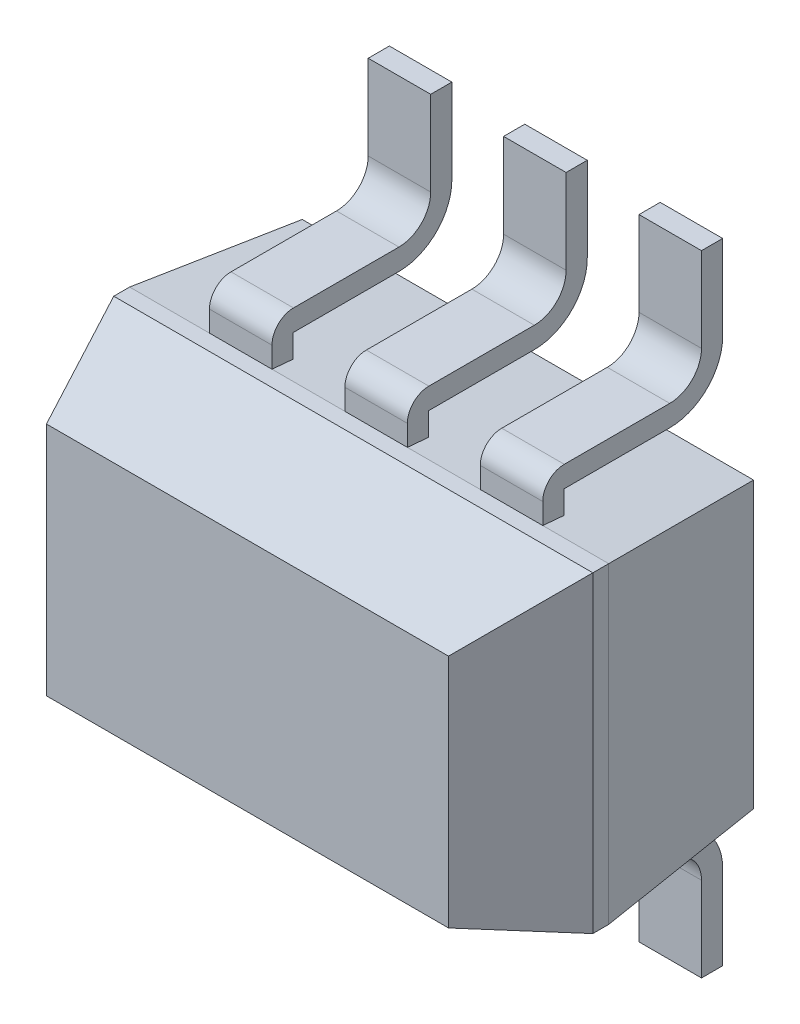
from build123d import *
from OCP.BRepFilletAPI import BRepFilletAPI_MakeChamfer

# Parameters (mm, degrees)
SKETCH1_W                = 2.3
SKETCH1_H                = 1.5
BASE_EXTRUDE_DEPTH       = 1.3462
CHAMFER1_SIZE            = 0.508
CHAMFER1_SIZE2           = 0.184896879
CHAMFER2_SIZE            = 0.762
CHAMFER2_SIZE2           = 0.066666362
SKETCH3_R                = 0.15
CUT_EXTRUDE1_DEPTH       = 0.127
BOSS_EXTRUDE_THIN3_DEPTH = 0.15
LPATTERN1_COUNT          = 3
LPATTERN1_PITCH          = 0.65
MIRROR1_COPY_1_DEPTH     = 0.15
MIRROR1_COPY_2_DEPTH     = 0.15


with BuildPart() as part:
    # Sketch1 → Base-Extrude (new body)
    with BuildSketch(Plane.XY):
        with Locations((3.200498433, 1.512)):
            Rectangle(SKETCH1_W, SKETCH1_H)
    extrude(amount=BASE_EXTRUDE_DEPTH)

    # Chamfer1: one chamfer whose edges measure the first distance from different faces: ONE call of the kernel's chamfer builder (chamfer() names one face for all edges)
    chamfer1_edges_1 = [part.edges().sort_by_distance(p)[0] for p in [
        (4.350498433, 1.512, 1.3462),
    ]]
    chamfer1_side_1 = [part.faces().sort_by_distance(p)[0] for p in [
        (4.350498433, 1.512, 0.6731),
    ]]
    chamfer1_edges_2 = [part.edges().sort_by_distance(p)[0] for p in [
        (3.200498433, 2.262, 1.3462),
    ]]
    chamfer1_side_2 = [part.faces().sort_by_distance(p)[0] for p in [
        (3.200498433, 2.262, 0.6731),
    ]]
    chamfer1_edges_3 = [part.edges().sort_by_distance(p)[0] for p in [
        (2.050498433, 1.512, 1.3462),
    ]]
    chamfer1_side_3 = [part.faces().sort_by_distance(p)[0] for p in [
        (2.050498433, 1.512, 0.6731),
    ]]
    chamfer1_edges_4 = [part.edges().sort_by_distance(p)[0] for p in [
        (3.200498433, 0.762, 1.3462),
    ]]
    chamfer1_side_4 = [part.faces().sort_by_distance(p)[0] for p in [
        (3.200498433, 0.762, 0.6731),
    ]]
    chamfer1 = BRepFilletAPI_MakeChamfer(part.part.solid().wrapped)
    for e in chamfer1_edges_1:
        chamfer1.Add(CHAMFER1_SIZE, CHAMFER1_SIZE2, e.wrapped, chamfer1_side_1[0].wrapped)  # the first distance lies on this face
    for e in chamfer1_edges_2:
        chamfer1.Add(CHAMFER1_SIZE, CHAMFER1_SIZE2, e.wrapped, chamfer1_side_2[0].wrapped)  # the first distance lies on this face
    for e in chamfer1_edges_3:
        chamfer1.Add(CHAMFER1_SIZE, CHAMFER1_SIZE2, e.wrapped, chamfer1_side_3[0].wrapped)  # the first distance lies on this face
    for e in chamfer1_edges_4:
        chamfer1.Add(CHAMFER1_SIZE, CHAMFER1_SIZE2, e.wrapped, chamfer1_side_4[0].wrapped)  # the first distance lies on this face
    add(Compound.cast(chamfer1.Shape()), mode=Mode.REPLACE)

    # Chamfer2: one chamfer whose edges measure the first distance from different faces: ONE call of the kernel's chamfer builder (chamfer() names one face for all edges)
    chamfer2_edges_1 = [part.edges().sort_by_distance(p)[0] for p in [
        (3.200498433, 2.262, 0),
    ]]
    chamfer2_side_1 = [part.faces().sort_by_distance(p)[0] for p in [
        (3.200498433, 2.262, 0.4191),
    ]]
    chamfer2_edges_2 = [part.edges().sort_by_distance(p)[0] for p in [
        (4.350498433, 1.512, 0),
    ]]
    chamfer2_side_2 = [part.faces().sort_by_distance(p)[0] for p in [
        (4.350498433, 1.512, 0.4191),
    ]]
    chamfer2_edges_3 = [part.edges().sort_by_distance(p)[0] for p in [
        (3.200498433, 0.762, 0),
    ]]
    chamfer2_side_3 = [part.faces().sort_by_distance(p)[0] for p in [
        (3.200498433, 0.762, 0.4191),
    ]]
    chamfer2_edges_4 = [part.edges().sort_by_distance(p)[0] for p in [
        (2.050498433, 1.512, 0),
    ]]
    chamfer2_side_4 = [part.faces().sort_by_distance(p)[0] for p in [
        (2.050498433, 1.512, 0.4191),
    ]]
    chamfer2 = BRepFilletAPI_MakeChamfer(part.part.solid().wrapped)
    for e in chamfer2_edges_1:
        chamfer2.Add(CHAMFER2_SIZE, CHAMFER2_SIZE2, e.wrapped, chamfer2_side_1[0].wrapped)  # the first distance lies on this face
    for e in chamfer2_edges_2:
        chamfer2.Add(CHAMFER2_SIZE, CHAMFER2_SIZE2, e.wrapped, chamfer2_side_2[0].wrapped)  # the first distance lies on this face
    for e in chamfer2_edges_3:
        chamfer2.Add(CHAMFER2_SIZE, CHAMFER2_SIZE2, e.wrapped, chamfer2_side_3[0].wrapped)  # the first distance lies on this face
    for e in chamfer2_edges_4:
        chamfer2.Add(CHAMFER2_SIZE, CHAMFER2_SIZE2, e.wrapped, chamfer2_side_4[0].wrapped)  # the first distance lies on this face
    add(Compound.cast(chamfer2.Shape()), mode=Mode.REPLACE)

    # Sketch3 → Cut-Extrude1 (cut)
    with BuildSketch(Plane(origin=(0.118935742, 0.142956615, 1.3462), x_dir=(1, 0, 0), z_dir=(0, 0, 1))):
        with Locations((1.946665812, 1.27)):
            Circle(SKETCH3_R)
    extrude(amount=-CUT_EXTRUDE1_DEPTH, mode=Mode.SUBTRACT)

    # Sketch4 → Boss-Extrude-Thin3 (add, symmetric)
    with BuildSketch(Plane(origin=(2.583898433, 0, 0), x_dir=(0, 0, -1), z_dir=(1, 0, 0))):
        with BuildLine():
            Line((0, 0), (0, 0.4064))
            ThreePointArc((0, 0.4064), (-0.044636927, 0.514163073), (-0.1524, 0.5588))
            Line((-0.1524, 0.5588), (-0.6588, 0.5588))
            ThreePointArc((-0.6588, 0.5588), (-0.73177342, 0.58902658), (-0.762, 0.662))
            Line((-0.762, 0.662), (-0.762, 1.062))
            Line((-0.762, 1.062), (-0.6604, 1.062))
            Line((-0.6604, 1.062), (-0.6604, 0.662))
            ThreePointArc((-0.6604, 0.662), (-0.659931371, 0.660868629), (-0.6588, 0.6604))
            Line((-0.6588, 0.6604), (-0.1524, 0.6604))
            ThreePointArc((-0.1524, 0.6604), (0.027205122, 0.586005122), (0.1016, 0.4064))
            Line((0.1016, 0.4064), (0.1016, 0))
            Line((0.1016, 0), (0, 0))
        make_face()
    boss_extrude_thin3 = extrude(amount=BOSS_EXTRUDE_THIN3_DEPTH, both=True)

    # LPattern1: Boss-Extrude-Thin3 ×3
    with Locations(*[(i * LPATTERN1_PITCH, 0, 0) for i in range(1, LPATTERN1_COUNT)]):
        add(boss_extrude_thin3)

    # Mirror1: Boss-Extrude-Thin3 across plane
    add(boss_extrude_thin3.mirror(Plane.ZX.offset(1.512)))

    # Mirror1 copy 1 sketch → Mirror1 copy 1 (add, symmetric)
    with BuildSketch(Plane(origin=(3.233898433, 3.024, 0), x_dir=(0, 0, -1), z_dir=(1, 0, 0))):
        with BuildLine():
            Line((0, 0), (0, -0.4064))
            ThreePointArc((0, -0.4064), (-0.044636927, -0.514163073), (-0.1524, -0.5588))
            Line((-0.1524, -0.5588), (-0.6588, -0.5588))
            ThreePointArc((-0.6588, -0.5588), (-0.73177342, -0.58902658), (-0.762, -0.662))
            Line((-0.762, -0.662), (-0.762, -1.062))
            Line((-0.762, -1.062), (-0.6604, -1.062))
            Line((-0.6604, -1.062), (-0.6604, -0.662))
            ThreePointArc((-0.6604, -0.662), (-0.659931371, -0.660868629), (-0.6588, -0.6604))
            Line((-0.6588, -0.6604), (-0.1524, -0.6604))
            ThreePointArc((-0.1524, -0.6604), (0.027205122, -0.586005122), (0.1016, -0.4064))
            Line((0.1016, -0.4064), (0.1016, 0))
            Line((0.1016, 0), (0, 0))
        make_face()
    extrude(amount=MIRROR1_COPY_1_DEPTH, both=True)

    # Mirror1 copy 2 sketch → Mirror1 copy 2 (add, symmetric)
    with BuildSketch(Plane(origin=(3.883898433, 3.024, 0), x_dir=(0, 0, -1), z_dir=(1, 0, 0))):
        with BuildLine():
            Line((0, 0), (0, -0.4064))
            ThreePointArc((0, -0.4064), (-0.044636927, -0.514163073), (-0.1524, -0.5588))
            Line((-0.1524, -0.5588), (-0.6588, -0.5588))
            ThreePointArc((-0.6588, -0.5588), (-0.73177342, -0.58902658), (-0.762, -0.662))
            Line((-0.762, -0.662), (-0.762, -1.062))
            Line((-0.762, -1.062), (-0.6604, -1.062))
            Line((-0.6604, -1.062), (-0.6604, -0.662))
            ThreePointArc((-0.6604, -0.662), (-0.659931371, -0.660868629), (-0.6588, -0.6604))
            Line((-0.6588, -0.6604), (-0.1524, -0.6604))
            ThreePointArc((-0.1524, -0.6604), (0.027205122, -0.586005122), (0.1016, -0.4064))
            Line((0.1016, -0.4064), (0.1016, 0))
            Line((0.1016, 0), (0, 0))
        make_face()
    extrude(amount=MIRROR1_COPY_2_DEPTH, both=True)


solid = part.part
